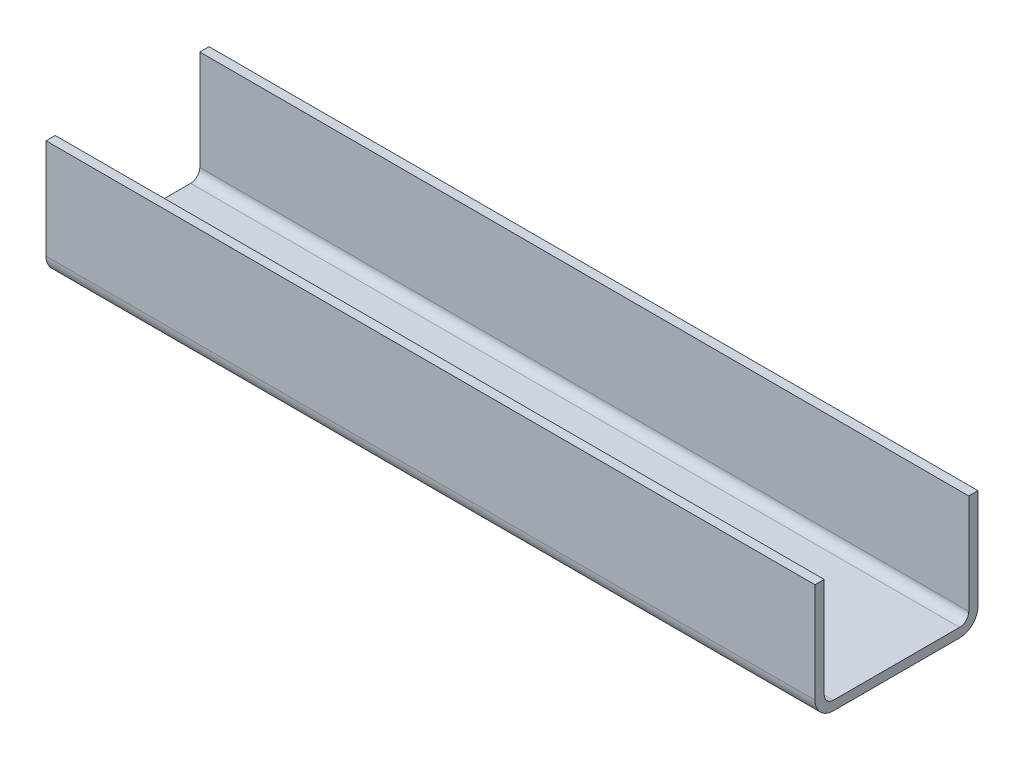
from build123d import *

# Parameters (mm, degrees)
TRACK_DEPTH = 125


with BuildPart() as part:
    # 草图1 → Track (new, symmetric)
    with BuildSketch(Plane(origin=(0, 0, 0), x_dir=(0, 0, -1), z_dir=(1, 0, 0))):
        with BuildLine():
            Line((-26.5, 38.5), (-26.5, 6))
            ThreePointArc((-26.5, 6), (-24.742640687, 1.757359313), (-20.5, 0))
            Line((-20.5, 0), (20.5, 0))
            ThreePointArc((20.5, 0), (24.742640687, 1.757359313), (26.5, 6))
            Line((26.5, 6), (26.5, 38.5))
            Line((26.5, 38.5), (23.5, 38.5))
            Line((23.5, 38.5), (23.5, 6))
            ThreePointArc((23.5, 6), (22.621320344, 3.878679656), (20.5, 3))
            Line((20.5, 3), (-20.5, 3))
            ThreePointArc((-20.5, 3), (-22.621320344, 3.878679656), (-23.5, 6))
            Line((-23.5, 6), (-23.5, 38.5))
            Line((-23.5, 38.5), (-26.5, 38.5))
        make_face()
    extrude(amount=TRACK_DEPTH, both=True)


solid = part.part
